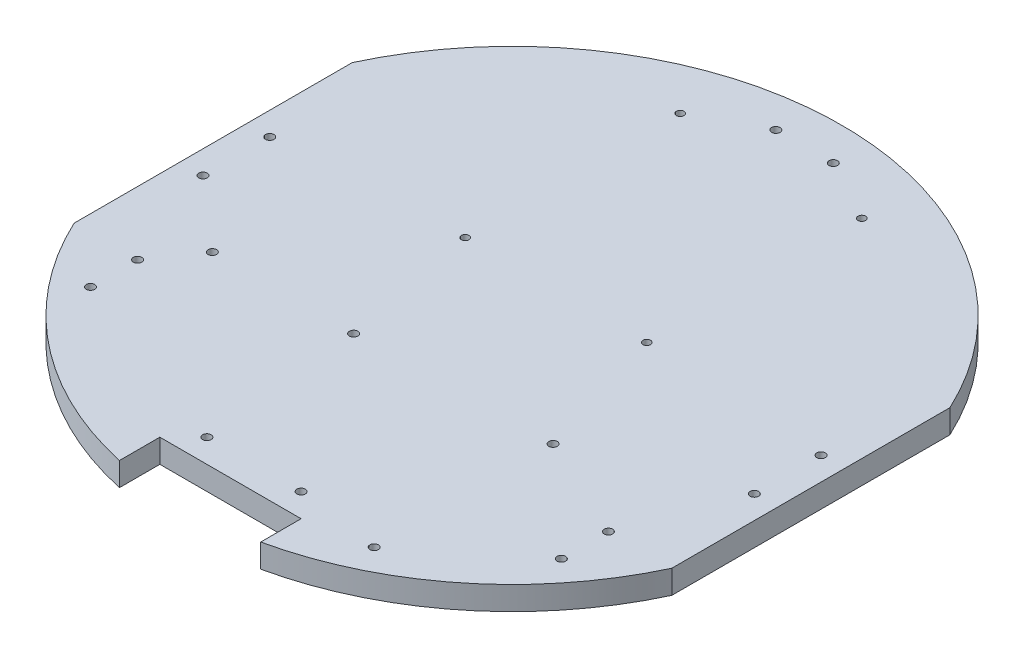
from build123d import *

# Parameters (mm, degrees)
MAIN_BODY_DEPTH     = 6.35
RASPBERRY_PI_REACH  = 122.169
SKETCH2_R           = 1.025
MOTOR_MOUNTS_REACH  = 122.169
SKETCH3_R           = 1.143
CUT_EXTRUDE3_REACH  = 122.169
SKETCH4_R           = 1.143
SKETCH5_R           = 1.143
GRABBER_MOUNT_DEPTH = 121.168600308
SKETCH6_R           = 1.143
FRONT_IR_DEPTH      = 121.168600308
SKETCH8_R           = 1.143
SIDE_IR_DEPTH       = 121.168600308
SKETCH9_R           = 1.143
CUT_EXTRUDE4_DEPTH  = 121.168600308
SKETCH10_W          = 38.1
SKETCH10_H          = 25.908
CUT_EXTRUDE5_DEPTH  = 121.168600308


with BuildPart() as part:
    # Sketch1 → Main Body (new body)
    with BuildSketch(Plane(origin=(0, 0, 0), x_dir=(1, 0, 0), z_dir=(0, 1, 0))):
        with BuildLine():
            Line((-80.603721998, 37.5), (-80.603721998, -37.5))
            ThreePointArc((-80.603721998, -37.5), (0, -88.9), (80.603721998, -37.5))
            Line((80.603721998, -37.5), (80.603721998, 37.5))
            ThreePointArc((80.603721998, 37.5), (0, 88.9), (-80.603721998, 37.5))
        make_face()
    extrude(amount=MAIN_BODY_DEPTH)

    # Sketch2 → Raspberry Pi (cut, up to next)
    with BuildSketch(Plane(origin=(0, 6.35, 0), x_dir=(1, 0, 0), z_dir=(0, 1, 0)), mode=Mode.PRIVATE) as raspberry_pi_sk1:
        with Locations(Location((24.5, 69.85, 0), (0, 0, 270))):
            Circle(SKETCH2_R)
    raspberry_pi_tool1 = extrude(raspberry_pi_sk1.sketch, amount=-RASPBERRY_PI_REACH, mode=Mode.PRIVATE) & part.part
    # Sketch2 → Raspberry Pi (cut, up to next)
    with BuildSketch(Plane(origin=(0, 6.35, 0), x_dir=(1, 0, 0), z_dir=(0, 1, 0)), mode=Mode.PRIVATE) as raspberry_pi_sk2:
        with Locations(Location((24.5, 11.85, 0), (0, 0, 270))):
            Circle(SKETCH2_R)
    raspberry_pi_tool2 = extrude(raspberry_pi_sk2.sketch, amount=-RASPBERRY_PI_REACH, mode=Mode.PRIVATE) & part.part
    # Sketch2 → Raspberry Pi (cut, up to next)
    with BuildSketch(Plane(origin=(0, 6.35, 0), x_dir=(1, 0, 0), z_dir=(0, 1, 0)), mode=Mode.PRIVATE) as raspberry_pi_sk3:
        with Locations(Location((-24.5, 11.85, 0), (0, 0, 270))):
            Circle(SKETCH2_R)
    raspberry_pi_tool3 = extrude(raspberry_pi_sk3.sketch, amount=-RASPBERRY_PI_REACH, mode=Mode.PRIVATE) & part.part
    # Sketch2 → Raspberry Pi (cut, up to next)
    with BuildSketch(Plane(origin=(0, 6.35, 0), x_dir=(1, 0, 0), z_dir=(0, 1, 0)), mode=Mode.PRIVATE) as raspberry_pi_sk4:
        with Locations(Location((-24.5, 69.85, 0), (0, 0, 270))):
            Circle(SKETCH2_R)
    raspberry_pi_tool4 = extrude(raspberry_pi_sk4.sketch, amount=-RASPBERRY_PI_REACH, mode=Mode.PRIVATE) & part.part
    add(raspberry_pi_tool1.solids().sort_by_distance((24.5, 6.35, -69.85))[0], mode=Mode.SUBTRACT)
    add(raspberry_pi_tool2.solids().sort_by_distance((24.5, 6.35, -11.85))[0], mode=Mode.SUBTRACT)
    add(raspberry_pi_tool3.solids().sort_by_distance((-24.5, 6.35, -11.85))[0], mode=Mode.SUBTRACT)
    add(raspberry_pi_tool4.solids().sort_by_distance((-24.5, 6.35, -69.85))[0], mode=Mode.SUBTRACT)

    # Sketch3 → Motor Mounts (cut, up to next)
    with BuildSketch(Plane(origin=(0, 6.35, 0), x_dir=(1, 0, 0), z_dir=(0, 1, 0)), mode=Mode.PRIVATE) as motor_mounts_sk1:
        with Locations(Location((-74.353721998, 9, 0), (0, 0, 270))):
            Circle(SKETCH3_R)
    motor_mounts_tool1 = extrude(motor_mounts_sk1.sketch, amount=-MOTOR_MOUNTS_REACH, mode=Mode.PRIVATE) & part.part
    # Sketch3 → Motor Mounts (cut, up to next)
    with BuildSketch(Plane(origin=(0, 6.35, 0), x_dir=(1, 0, 0), z_dir=(0, 1, 0)), mode=Mode.PRIVATE) as motor_mounts_sk2:
        with Locations(Location((-74.353721998, -9, 0), (0, 0, 270))):
            Circle(SKETCH3_R)
    motor_mounts_tool2 = extrude(motor_mounts_sk2.sketch, amount=-MOTOR_MOUNTS_REACH, mode=Mode.PRIVATE) & part.part
    # Sketch3 → Motor Mounts (cut, up to next)
    with BuildSketch(Plane(origin=(0, 6.35, 0), x_dir=(1, 0, 0), z_dir=(0, 1, 0)), mode=Mode.PRIVATE) as motor_mounts_sk3:
        with Locations(Location((74.353721998, 9, 0), (0, 0, 270))):
            Circle(SKETCH3_R)
    motor_mounts_tool3 = extrude(motor_mounts_sk3.sketch, amount=-MOTOR_MOUNTS_REACH, mode=Mode.PRIVATE) & part.part
    # Sketch3 → Motor Mounts (cut, up to next)
    with BuildSketch(Plane(origin=(0, 6.35, 0), x_dir=(1, 0, 0), z_dir=(0, 1, 0)), mode=Mode.PRIVATE) as motor_mounts_sk4:
        with Locations(Location((74.353721998, -9, 0), (0, 0, 270))):
            Circle(SKETCH3_R)
    motor_mounts_tool4 = extrude(motor_mounts_sk4.sketch, amount=-MOTOR_MOUNTS_REACH, mode=Mode.PRIVATE) & part.part
    add(motor_mounts_tool1.solids().sort_by_distance((-74.353722, 6.35, -9))[0], mode=Mode.SUBTRACT)
    add(motor_mounts_tool2.solids().sort_by_distance((-74.353722, 6.35, 9))[0], mode=Mode.SUBTRACT)
    add(motor_mounts_tool3.solids().sort_by_distance((74.353722, 6.35, -9))[0], mode=Mode.SUBTRACT)
    add(motor_mounts_tool4.solids().sort_by_distance((74.353722, 6.35, 9))[0], mode=Mode.SUBTRACT)

    # Sketch4 → Cut-Extrude3 (cut, up to next)
    with BuildSketch(Plane(origin=(0, 6.35, 0), x_dir=(1, 0, 0), z_dir=(0, 1, 0)), mode=Mode.PRIVATE) as cut_extrude3_sk1:
        with Locations(Location((-7.747, 78.9, 0), (0, 0, 270))):
            Circle(SKETCH4_R)
    cut_extrude3_tool1 = extrude(cut_extrude3_sk1.sketch, amount=-CUT_EXTRUDE3_REACH, mode=Mode.PRIVATE) & part.part
    # Sketch4 → Cut-Extrude3 (cut, up to next)
    with BuildSketch(Plane(origin=(0, 6.35, 0), x_dir=(1, 0, 0), z_dir=(0, 1, 0)), mode=Mode.PRIVATE) as cut_extrude3_sk2:
        with Locations(Location((7.747, 78.9, 0), (0, 0, 270))):
            Circle(SKETCH4_R)
    cut_extrude3_tool2 = extrude(cut_extrude3_sk2.sketch, amount=-CUT_EXTRUDE3_REACH, mode=Mode.PRIVATE) & part.part
    add(cut_extrude3_tool1.solids().sort_by_distance((-7.747, 6.35, -78.9))[0], mode=Mode.SUBTRACT)
    add(cut_extrude3_tool2.solids().sort_by_distance((7.747, 6.35, -78.9))[0], mode=Mode.SUBTRACT)

    # Sketch5 → Grabber Mount (cut, through all)
    with BuildSketch(Plane(origin=(0, 6.35, 0), x_dir=(1, 0, 0), z_dir=(0, 1, 0))):
        with Locations(Location((35.56, -24.48608666, 0), (0, 0, 270))):
            Circle(SKETCH5_R)
        with Locations(Location((35.56, -72.74608666, 0), (0, 0, 270))):
            Circle(SKETCH5_R)
    extrude(amount=-GRABBER_MOUNT_DEPTH, mode=Mode.SUBTRACT)

    # Sketch6 → Front IR (cut, through all)
    with BuildSketch(Plane(origin=(0, 6.35, 0), x_dir=(1, 0, 0), z_dir=(0, 1, 0))):
        with Locations(Location((-12.7, -69.596, 0), (0, 0, 270))):
            Circle(SKETCH6_R)
        with Locations(Location((12.7, -69.596, 0), (0, 0, 270))):
            Circle(SKETCH6_R)
    extrude(amount=-FRONT_IR_DEPTH, mode=Mode.SUBTRACT)

    # Sketch8 → Side IR (cut, through all)
    with BuildSketch(Plane(origin=(0, 6.35, 0), x_dir=(1, 0, 0), z_dir=(0, 1, 0))):
        with Locations(Location((-63.5, -37.5, 0), (0, 0, 270))):
            Circle(SKETCH8_R)
        with Locations(Location((-63.5, -50.2, 0), (0, 0, 270))):
            Circle(SKETCH8_R)
        with Locations(Location((63.5, -50.2, 0), (0, 0, 90))):
            Circle(SKETCH8_R)
        with Locations(Location((63.5, -37.5, 0), (0, 0, 90))):
            Circle(SKETCH8_R)
    extrude(amount=-SIDE_IR_DEPTH, mode=Mode.SUBTRACT)

    # Sketch9 → Cut-Extrude4 (cut, through all)
    with BuildSketch(Plane(origin=(0, 6.35, 0), x_dir=(1, 0, 0), z_dir=(0, 1, 0))):
        with Locations(Location((-55.203721998, -25.62908666, 0), (0, 0, 270))):
            Circle(SKETCH9_R)
        with Locations(Location((-17.103721998, -25.62908666, 0), (0, 0, 270))):
            Circle(SKETCH9_R)
    extrude(amount=-CUT_EXTRUDE4_DEPTH, mode=Mode.SUBTRACT)

    # Sketch10 → Cut-Extrude5 (cut, through all)
    with BuildSketch(Plane(origin=(0, 6.35, 0), x_dir=(1, 0, 0), z_dir=(0, 1, 0))):
        with Locations((0, -88.9)):
            Rectangle(SKETCH10_W, SKETCH10_H)
    extrude(amount=-CUT_EXTRUDE5_DEPTH, mode=Mode.SUBTRACT)


solid = part.part
